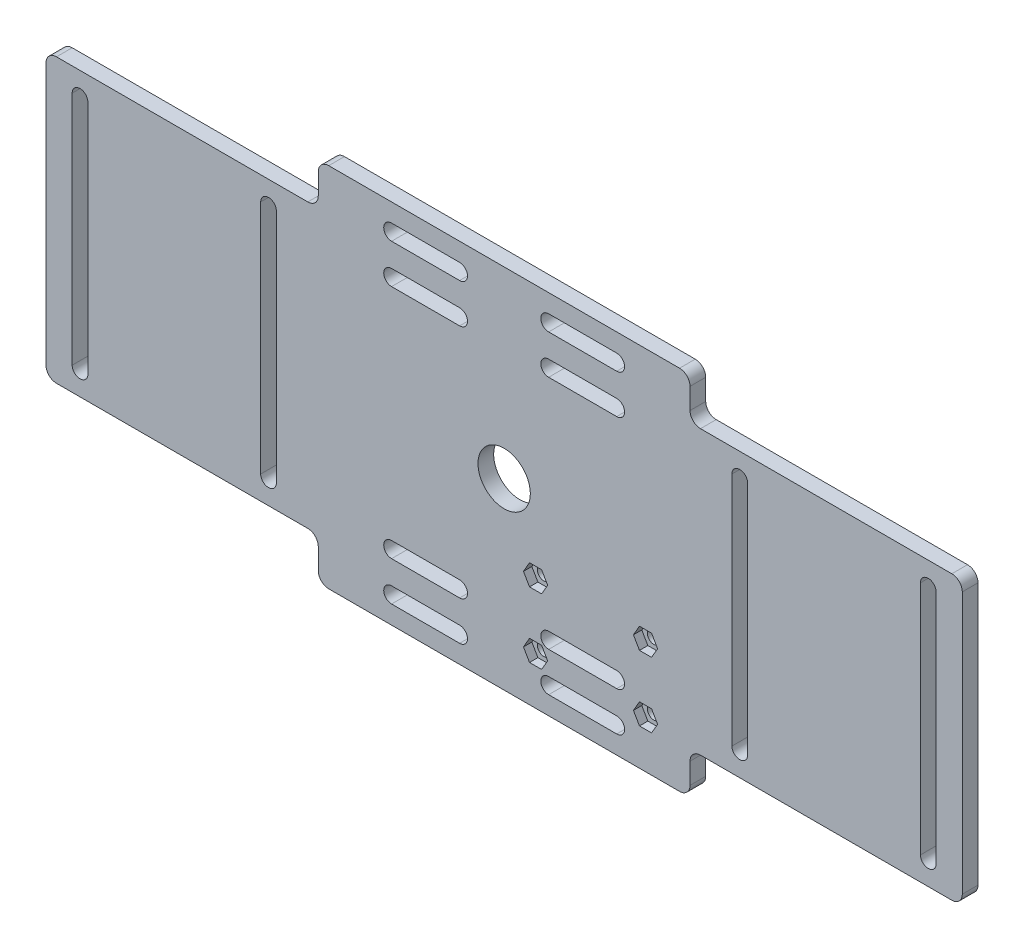
from build123d import *
from OCP.BRepFilletAPI import BRepFilletAPI_MakeChamfer

# Parameters (mm, degrees)
EXTRUDE_1_DEPTH     = 3
SKETCH_2_R          = 5
SKETCH_2_R_2        = 1.25
CUT_EXTRUDE_1_DEPTH = 95.288122264
CUT_EXTRUDE_2_DEPTH = 1.6
SKETCH_4_R          = 2
SKETCH_4_R_2        = 1.25
EXTRUDE_2_DEPTH     = 2
CHAMFER_1_SIZE      = 0.5
CHAMFER_1_SIZE2     = 0.288675135


with BuildPart() as part:
    # 草圖1 → 填料-伸長1 (new body)
    with BuildSketch(Plane.XY):
        with BuildLine():
            Line((35.5, 33), (35.5, 29))
            ThreePointArc((35.5, 29), (36.085786438, 27.585786438), (37.5, 27))
            Line((37.5, 27), (85.5, 27))
            ThreePointArc((85.5, 27), (86.914213562, 26.414213562), (87.5, 25))
            Line((87.5, 25), (87.5, -25))
            ThreePointArc((87.5, -25), (86.914213562, -26.414213562), (85.5, -27))
            Line((85.5, -27), (37.5, -27))
            ThreePointArc((37.5, -27), (36.085786438, -27.585786438), (35.5, -29))
            Line((35.5, -29), (35.5, -33))
            ThreePointArc((35.5, -33), (34.914213562, -34.414213562), (33.5, -35))
            Line((33.5, -35), (-33.5, -35))
            ThreePointArc((-33.5, -35), (-34.914213562, -34.414213562), (-35.5, -33))
            Line((-35.5, -33), (-35.5, -29))
            ThreePointArc((-35.5, -29), (-36.085786438, -27.585786438), (-37.5, -27))
            Line((-37.5, -27), (-85.5, -27))
            ThreePointArc((-85.5, -27), (-86.914213562, -26.414213562), (-87.5, -25))
            Line((-87.5, -25), (-87.5, 25))
            ThreePointArc((-87.5, 25), (-86.914213562, 26.414213562), (-85.5, 27))
            Line((-85.5, 27), (-37.5, 27))
            ThreePointArc((-37.5, 27), (-36.085786438, 27.585786438), (-35.5, 29))
            Line((-35.5, 29), (-35.5, 33))
            ThreePointArc((-35.5, 33), (-34.914213562, 34.414213562), (-33.5, 35))
            Line((-33.5, 35), (33.5, 35))
            ThreePointArc((33.5, 35), (34.914213562, 34.414213562), (35.5, 33))
        make_face()
    extrude(amount=EXTRUDE_1_DEPTH)

    # 草圖2 → 除料-伸長1 (cut, through all)
    with BuildSketch(Plane.XY.offset(3)):
        Circle(SKETCH_2_R)
        with Locations((27, -13.5)):
            Circle(SKETCH_2_R_2)
        with Locations((6, -13.5)):
            Circle(SKETCH_2_R_2)
        with Locations((6, -26)):
            Circle(SKETCH_2_R_2)
        with Locations((27, -26)):
            Circle(SKETCH_2_R_2)
        with BuildLine():
            Line((43.5, -22.5), (43.5, 22.5))
            ThreePointArc((43.5, 22.5), (45, 24), (46.5, 22.5))
            Line((46.5, 22.5), (46.5, -22.5))
            ThreePointArc((46.5, -22.5), (45, -24), (43.5, -22.5))
        make_face()
        with BuildLine():
            Line((-46.5, -22.5), (-46.5, 22.5))
            ThreePointArc((-46.5, 22.5), (-45, 24), (-43.5, 22.5))
            Line((-43.5, 22.5), (-43.5, -22.5))
            ThreePointArc((-43.5, -22.5), (-45, -24), (-46.5, -22.5))
        make_face()
        with BuildLine():
            Line((-82.5, -22.5), (-82.5, 22.5))
            ThreePointArc((-82.5, 22.5), (-81, 24), (-79.5, 22.5))
            Line((-79.5, 22.5), (-79.5, -22.5))
            ThreePointArc((-79.5, -22.5), (-81, -24), (-82.5, -22.5))
        make_face()
        with BuildLine():
            Line((79.5, -22.5), (79.5, 22.5))
            ThreePointArc((79.5, 22.5), (81, 24), (82.5, 22.5))
            Line((82.5, 22.5), (82.5, -22.5))
            ThreePointArc((82.5, -22.5), (81, -24), (79.5, -22.5))
        make_face()
        with BuildLine():
            Line((21.5, -31.5), (8.5, -31.5))
            ThreePointArc((8.5, -31.5), (7, -30), (8.5, -28.5))
            Line((8.5, -28.5), (21.5, -28.5))
            ThreePointArc((21.5, -28.5), (23, -30), (21.5, -31.5))
        make_face()
        with BuildLine():
            Line((-21.5, -31.5), (-8.5, -31.5))
            ThreePointArc((-8.5, -31.5), (-7, -30), (-8.5, -28.5))
            Line((-8.5, -28.5), (-21.5, -28.5))
            ThreePointArc((-21.5, -28.5), (-23, -30), (-21.5, -31.5))
        make_face()
        with BuildLine():
            Line((21.5, 31.5), (8.5, 31.5))
            ThreePointArc((8.5, 31.5), (7, 30), (8.5, 28.5))
            Line((8.5, 28.5), (21.5, 28.5))
            ThreePointArc((21.5, 28.5), (23, 30), (21.5, 31.5))
        make_face()
        with BuildLine():
            Line((-21.5, 31.5), (-8.5, 31.5))
            ThreePointArc((-8.5, 31.5), (-7, 30), (-8.5, 28.5))
            Line((-8.5, 28.5), (-21.5, 28.5))
            ThreePointArc((-21.5, 28.5), (-23, 30), (-21.5, 31.5))
        make_face()
        with BuildLine():
            Line((21.5, 24), (8.5, 24))
            ThreePointArc((8.5, 24), (7, 22.5), (8.5, 21))
            Line((8.5, 21), (21.5, 21))
            ThreePointArc((21.5, 21), (23, 22.5), (21.5, 24))
        make_face()
        with BuildLine():
            Line((-21.5, 24), (-8.5, 24))
            ThreePointArc((-8.5, 24), (-7, 22.5), (-8.5, 21))
            Line((-8.5, 21), (-21.5, 21))
            ThreePointArc((-21.5, 21), (-23, 22.5), (-21.5, 24))
        make_face()
        with BuildLine():
            Line((-21.5, -24), (-8.5, -24))
            ThreePointArc((-8.5, -24), (-7, -22.5), (-8.5, -21))
            Line((-8.5, -21), (-21.5, -21))
            ThreePointArc((-21.5, -21), (-23, -22.5), (-21.5, -24))
        make_face()
        with BuildLine():
            Line((21.5, -24), (8.5, -24))
            ThreePointArc((8.5, -24), (7, -22.5), (8.5, -21))
            Line((8.5, -21), (21.5, -21))
            ThreePointArc((21.5, -21), (23, -22.5), (21.5, -24))
        make_face()
    extrude(amount=-CUT_EXTRUDE_1_DEPTH, mode=Mode.SUBTRACT)

    # 草圖3 → 除料-伸長2 (cut)
    with BuildSketch(Plane.XY.offset(3)):
        Polygon((29.309401077, -26), (28.154700538, -24), (25.845299462, -24), (24.690598923, -26), (25.845299462, -28), (28.154700538, -28), align=None)
        Polygon((8.309401077, -26), (7.154700538, -24), (4.845299462, -24), (3.690598923, -26), (4.845299462, -28), (7.154700538, -28), align=None)
        Polygon((29.309401077, -13.5), (28.154700538, -11.5), (25.845299462, -11.5), (24.690598923, -13.5), (25.845299462, -15.5), (28.154700538, -15.5), align=None)
        Polygon((8.309401077, -13.5), (7.154700538, -11.5), (4.845299462, -11.5), (3.690598923, -13.5), (4.845299462, -15.5), (7.154700538, -15.5), align=None)
    extrude(amount=-CUT_EXTRUDE_2_DEPTH, mode=Mode.SUBTRACT)

    # 草圖4 → 填料-伸長2 (add)
    # profile 1 of 4: a face of its own
    with BuildSketch(Plane(origin=(0, 0, 0), x_dir=(-1, 0, 0), z_dir=(0, 0, -1))):
        with Locations(Location((-27, -13.5, 0), (0, 0, 180))):
            Circle(SKETCH_4_R)
        with Locations(Location((-27, -13.5, 0), (0, 0, 180))):
            Circle(SKETCH_4_R_2, mode=Mode.SUBTRACT)
    # profile 2 of 4: a face of its own
    with BuildSketch(Plane(origin=(0, 0, 0), x_dir=(-1, 0, 0), z_dir=(0, 0, -1))):
        with Locations(Location((-27, -26, 0), (0, 0, 180))):
            Circle(SKETCH_4_R)
        with Locations(Location((-27, -26, 0), (0, 0, 180))):
            Circle(SKETCH_4_R_2, mode=Mode.SUBTRACT)
    # profile 3 of 4: a face of its own
    with BuildSketch(Plane(origin=(0, 0, 0), x_dir=(-1, 0, 0), z_dir=(0, 0, -1))):
        with Locations(Location((-6, -13.5, 0), (0, 0, 180))):
            Circle(SKETCH_4_R)
        with Locations(Location((-6, -13.5, 0), (0, 0, 180))):
            Circle(SKETCH_4_R_2, mode=Mode.SUBTRACT)
    # profile 4 of 4: a face of its own
    with BuildSketch(Plane(origin=(0, 0, 0), x_dir=(-1, 0, 0), z_dir=(0, 0, -1))):
        with Locations(Location((-6, -26, 0), (0, 0, 180))):
            Circle(SKETCH_4_R)
        with Locations(Location((-6, -26, 0), (0, 0, 180))):
            Circle(SKETCH_4_R_2, mode=Mode.SUBTRACT)
    extrude(amount=EXTRUDE_2_DEPTH)

    # 導角1: one chamfer whose edges measure the first distance from different faces: ONE call of the kernel's chamfer builder (chamfer() names one face for all edges)
    chamfer_1_edges_1 = [part.edges().sort_by_distance(p)[0] for p in [
        (25.75, -13.5, -2),
    ]]
    chamfer_1_side_1 = [part.faces().sort_by_distance(p)[0] for p in [
        (25.056568542, -13.5, -2),
    ]]
    chamfer_1_edges_2 = [part.edges().sort_by_distance(p)[0] for p in [
        (25.75, -26, -2),
    ]]
    chamfer_1_side_2 = [part.faces().sort_by_distance(p)[0] for p in [
        (25.056568542, -26, -2),
    ]]
    chamfer_1_edges_3 = [part.edges().sort_by_distance(p)[0] for p in [
        (4.75, -13.5, -2),
    ]]
    chamfer_1_side_3 = [part.faces().sort_by_distance(p)[0] for p in [
        (4.056568542, -13.5, -2),
    ]]
    chamfer_1_edges_4 = [part.edges().sort_by_distance(p)[0] for p in [
        (4.75, -26, -2),
    ]]
    chamfer_1_side_4 = [part.faces().sort_by_distance(p)[0] for p in [
        (4.056568542, -26, -2),
    ]]
    chamfer_1 = BRepFilletAPI_MakeChamfer(part.part.solid().wrapped)
    for e in chamfer_1_edges_1:
        chamfer_1.Add(CHAMFER_1_SIZE, CHAMFER_1_SIZE2, e.wrapped, chamfer_1_side_1[0].wrapped)  # the first distance lies on this face
    for e in chamfer_1_edges_2:
        chamfer_1.Add(CHAMFER_1_SIZE, CHAMFER_1_SIZE2, e.wrapped, chamfer_1_side_2[0].wrapped)  # the first distance lies on this face
    for e in chamfer_1_edges_3:
        chamfer_1.Add(CHAMFER_1_SIZE, CHAMFER_1_SIZE2, e.wrapped, chamfer_1_side_3[0].wrapped)  # the first distance lies on this face
    for e in chamfer_1_edges_4:
        chamfer_1.Add(CHAMFER_1_SIZE, CHAMFER_1_SIZE2, e.wrapped, chamfer_1_side_4[0].wrapped)  # the first distance lies on this face
    add(Compound.cast(chamfer_1.Shape()), mode=Mode.REPLACE)


solid = part.part
